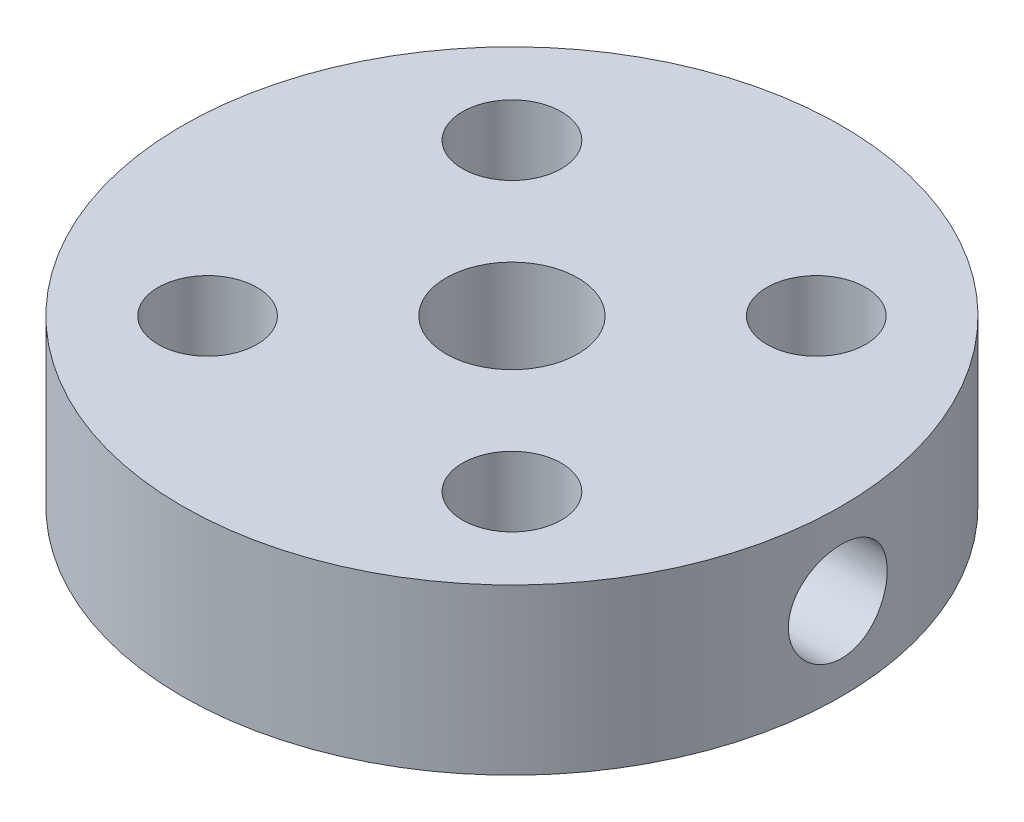
from build123d import *

# Parameters (mm, degrees)
SKETCH_1_R          = 1.5
EXTRUDE_1_DEPTH     = 5
SKETCH_2_R          = 1.5
CUT_EXTRUDE_4_DEPTH = 9


with BuildPart() as part:
    # Эскиз1 → Бобышка-Вытянуть1 (new body)
    # profile 1 of 2: a face of its own
    with BuildSketch(Plane(origin=(0, 0, 0), x_dir=(1, 0, 0), z_dir=(0, 1, 0))):
        with BuildLine():
            Line((0, 10), (0, 2))
            ThreePointArc((0, 2), (0.765366865, 1.847759065), (1.414213562, 1.414213562))
            Line((1.414213562, 1.414213562), (3.556747109, 3.556747109))
            ThreePointArc((3.556747109, 3.556747109), (3.556747109, 5.678067453), (5.678067453, 5.678067453))
            Line((5.678067453, 5.678067453), (7.071067812, 7.071067812))
            ThreePointArc((7.071067812, 7.071067812), (3.826834324, 9.238795325), (0, 10))
        make_face()
    # profile 2 of 2: a face of its own
    with BuildSketch(Plane(origin=(0, 0, 0), x_dir=(1, 0, 0), z_dir=(0, 1, 0))):
        with BuildLine():
            ThreePointArc((2, 0), (-1.414213562, -1.414213562), (0, 2))
            Line((0, 2), (0, 10))
            ThreePointArc((0, 10), (-7.071067812, -7.071067812), (10, 0))
            ThreePointArc((10, 0), (9.238795325, 3.826834324), (7.071067812, 7.071067812))
            Line((7.071067812, 7.071067812), (5.678067453, 5.678067453))
            ThreePointArc((5.678067453, 5.678067453), (6.00322658, 5.19143243), (6.117407281, 4.617407281))
            ThreePointArc((6.117407281, 4.617407281), (5.19143243, 3.231587982), (3.556747109, 3.556747109))
            Line((3.556747109, 3.556747109), (1.414213562, 1.414213562))
            ThreePointArc((1.414213562, 1.414213562), (1.847759065, 0.765366865), (2, 0))
        make_face()
        with Locations(Location((-4.617407281, -4.617407281, 0), (0, 0, 270))):
            Circle(SKETCH_1_R, mode=Mode.SUBTRACT)
        with Locations(Location((4.617407281, -4.617407281, 0), (0, 0, 270))):
            Circle(SKETCH_1_R, mode=Mode.SUBTRACT)
        with Locations(Location((-4.617407281, 4.617407281, 0), (0, 0, 270))):
            Circle(SKETCH_1_R, mode=Mode.SUBTRACT)
    extrude(amount=EXTRUDE_1_DEPTH)

    # Эскиз2 → Вырез-Вытянуть4 (cut)
    with BuildSketch(Plane(origin=(10, 0, 0), x_dir=(0, 0, -1), z_dir=(1, 0, 0))):
        with Locations((0, 2.5)):
            Circle(SKETCH_2_R)
    extrude(amount=-CUT_EXTRUDE_4_DEPTH, mode=Mode.SUBTRACT)


solid = part.part
